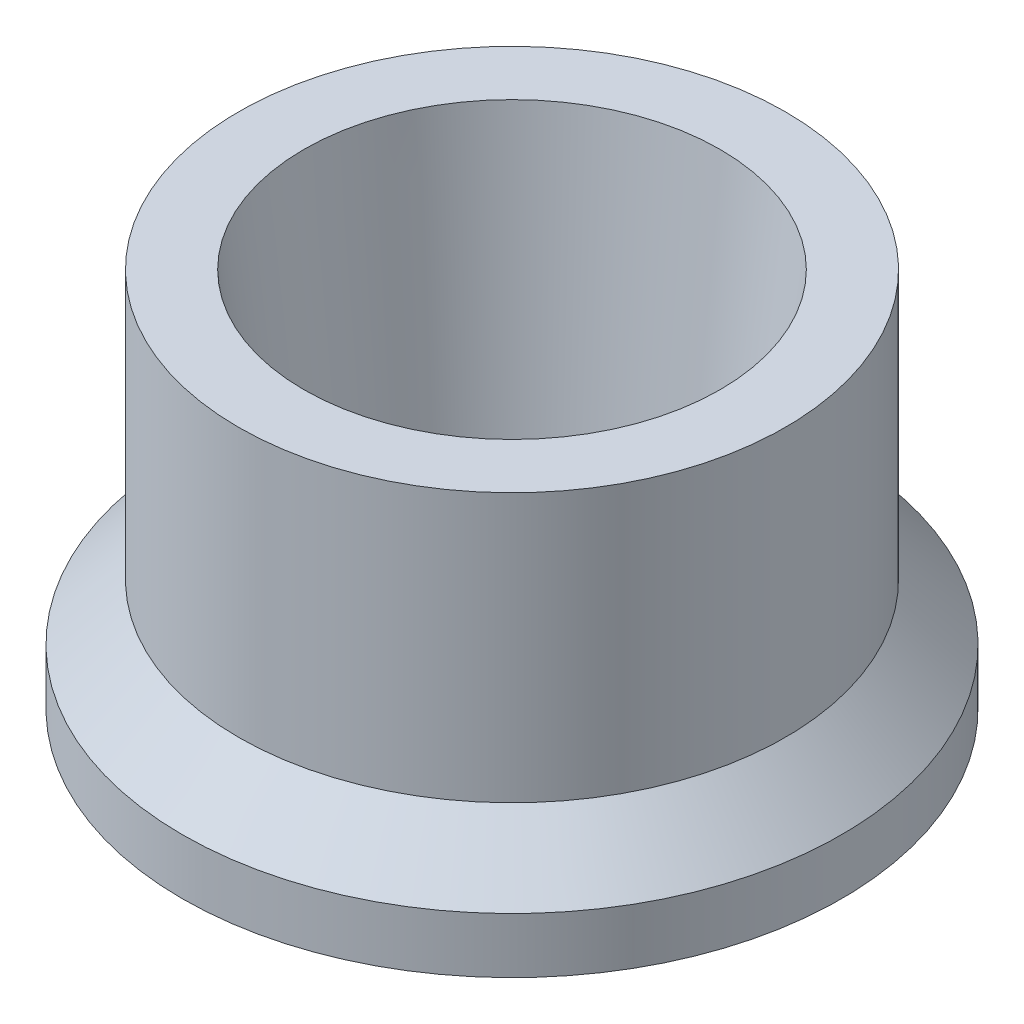
from build123d import *


with BuildPart() as part:
    # Sketch1 → Revolve1 (revolve)
    with BuildSketch(Plane.XY, mode=Mode.PRIVATE) as revolve1_sk:
        Polygon((3.048, 0), (3.81, 6.9596), (5.0038, 6.9596), (5.0038, 2.0447), (6.0325, 1.016), (6.0325, 0), align=None)
    revolve(revolve1_sk.sketch.rotate(Axis((0, 0, 0), (0, 1, 0)), 90), axis=Axis((0, 0, 0), (0, 1, 0)))


solid = part.part
